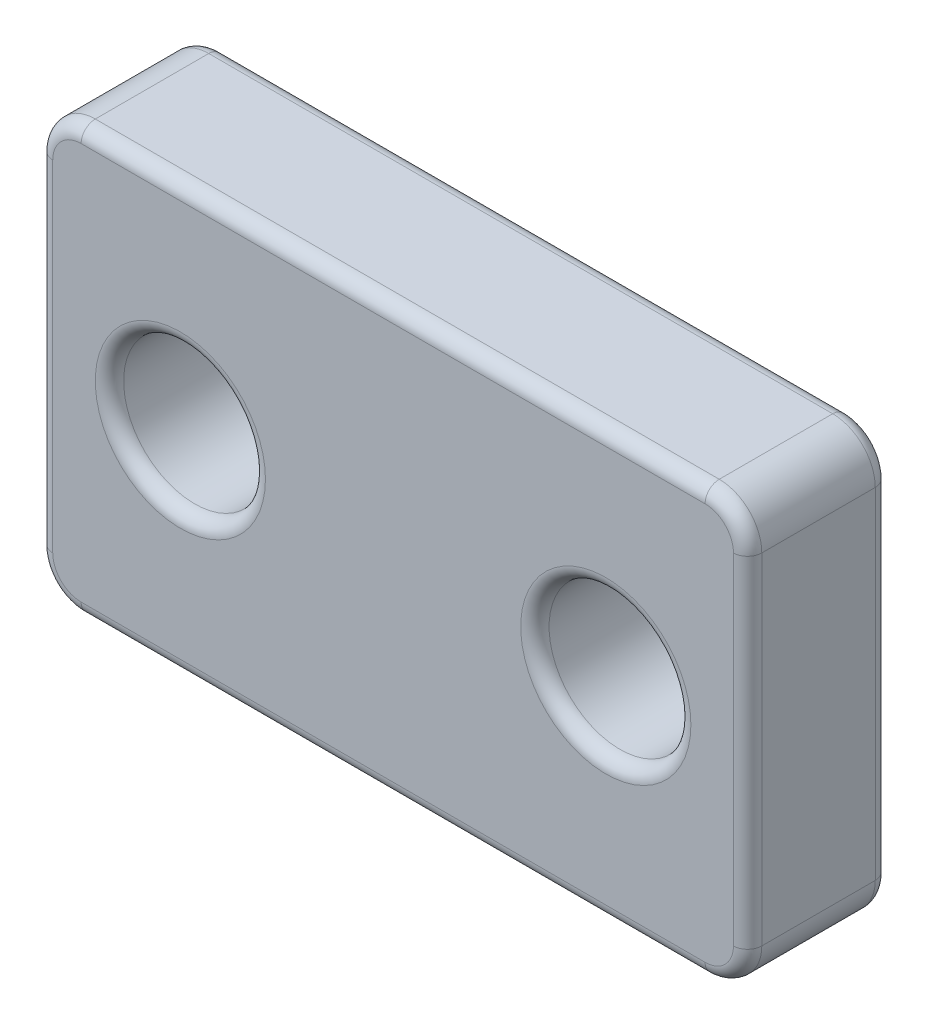
from build123d import *

# Parameters (mm, degrees)
SKETCH1_W           = 50
SKETCH1_H           = 30
BOSS_EXTRUDE1_DEPTH = 10
SKETCH2_R           = 5
CUT_EXTRUDE1_DEPTH  = 10
FILLET1_R           = 3
FILLET2_R           = 1


with BuildPart() as part:
    # Sketch1 → Boss-Extrude1 (new body)
    with BuildSketch(Plane.XY):
        Rectangle(SKETCH1_W, SKETCH1_H)
    extrude(amount=BOSS_EXTRUDE1_DEPTH)

    # Sketch2 → Cut-Extrude1 (cut)
    with BuildSketch(Plane.XY.offset(10)):
        with Locations((-15, 0)):
            Circle(SKETCH2_R)
        with Locations((15, 0)):
            Circle(SKETCH2_R)
    extrude(amount=-CUT_EXTRUDE1_DEPTH, mode=Mode.SUBTRACT)

    # Fillet1
    fillet1_edges = [part.edges().sort_by_distance(p)[0] for p in [
        (-25, 15, 5),
        (25, 15, 5),
        (25, -15, 5),
        (-25, -15, 5),
    ]]
    fillet(fillet1_edges, radius=FILLET1_R)

    # Fillet2
    fillet2_edges = [part.edges().sort_by_distance(p)[0] for p in [
        (-20, 0, 0),
        (-20, 0, 10),
        (10, 0, 0),
        (10, 0, 10),
        (0, -15, 0),
        (0, -15, 10),
        (-25, 0, 0),
        (0, 15, 0),
        (25, 0, 0),
        (24.121320344, 14.121320344, 0),
        (-24.121320344, 14.121320344, 0),
        (24.121320344, -14.121320344, 0),
        (-24.121320344, -14.121320344, 0),
        (-25, 0, 10),
        (25, 0, 10),
        (0, 15, 10),
        (24.121320344, 14.121320344, 10),
        (-24.121320344, 14.121320344, 10),
        (24.121320344, -14.121320344, 10),
        (-24.121320344, -14.121320344, 10),
    ]]
    fillet(fillet2_edges, radius=FILLET2_R)


solid = part.part
